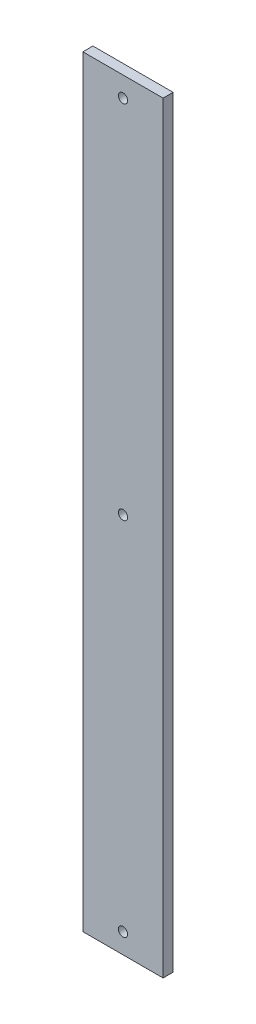
from build123d import *

# Parameters (mm, degrees)
SKETCH2_W           = 25.4
SKETCH2_H           = 241.3
SKETCH2_R           = 1.4605
BOSS_EXTRUDE1_DEPTH = 3.175


with BuildPart() as part:
    # Sketch2 → Boss-Extrude1 (new body)
    with BuildSketch(Plane.XY):
        with Locations((12.7, 120.65)):
            Rectangle(SKETCH2_W, SKETCH2_H)
        with Locations((12.7, 234.95)):
            Circle(SKETCH2_R, mode=Mode.SUBTRACT)
        with Locations((12.7, 6.35)):
            Circle(SKETCH2_R, mode=Mode.SUBTRACT)
        with Locations((12.7, 120.65)):
            Circle(SKETCH2_R, mode=Mode.SUBTRACT)
    extrude(amount=BOSS_EXTRUDE1_DEPTH)


solid = part.part
